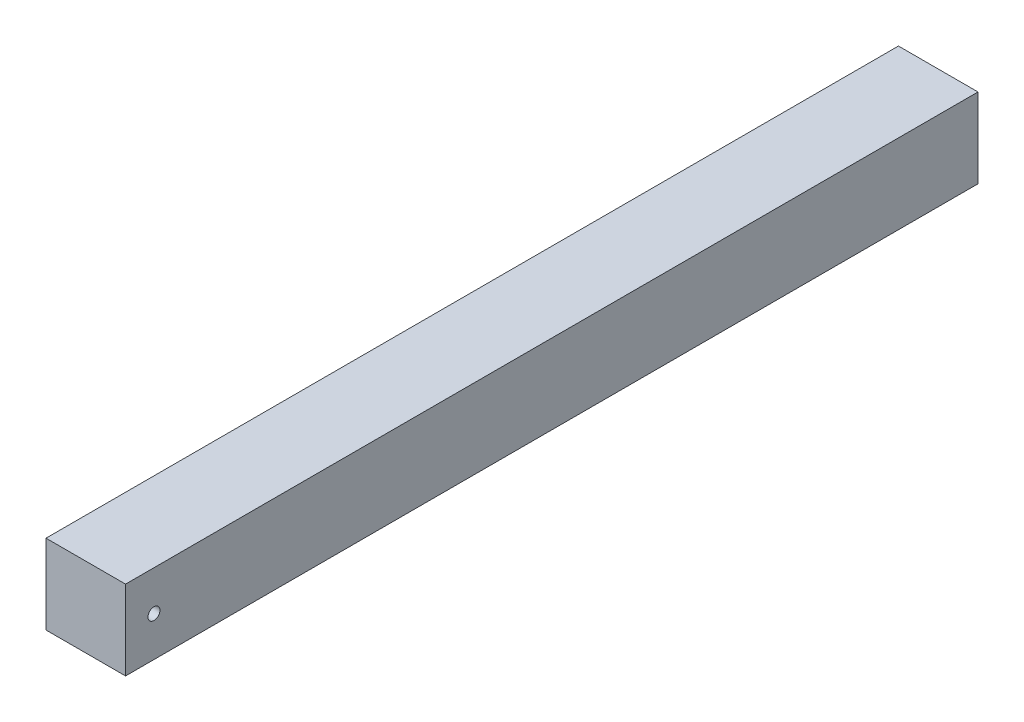
from build123d import *

# Parameters (mm, degrees)
SKETCH_1_W               = 14
SKETCH_1_H               = 14
EXTRUDE_1_DEPTH          = 150
CUT_EXTRUDE_1_DEPTH      = 151.326311736
CUT_EXTRUDE_1_DEPTH_BACK = 151.326311736
SKETCH_2_R               = 1.05


with BuildPart() as part:
    # ｽｹｯﾁ1 → ﾎﾞｽ - 押し出し1 (new body)
    with BuildSketch(Plane.XY):
        Rectangle(SKETCH_1_W, SKETCH_1_H)
    extrude(amount=EXTRUDE_1_DEPTH)

    # ｽｹｯﾁ2 → ｶｯﾄ - 押し出し1 (cut, two sides: drawn at the far end of the back side and taken through both)
    with BuildSketch(Plane(origin=(0, 0, 0), x_dir=(0, 0, -1), z_dir=(1, 0, 0)).offset(-CUT_EXTRUDE_1_DEPTH_BACK)):
        with Locations((-145, 0)):
            Circle(SKETCH_2_R)
    extrude(amount=CUT_EXTRUDE_1_DEPTH + CUT_EXTRUDE_1_DEPTH_BACK, mode=Mode.SUBTRACT)


solid = part.part
